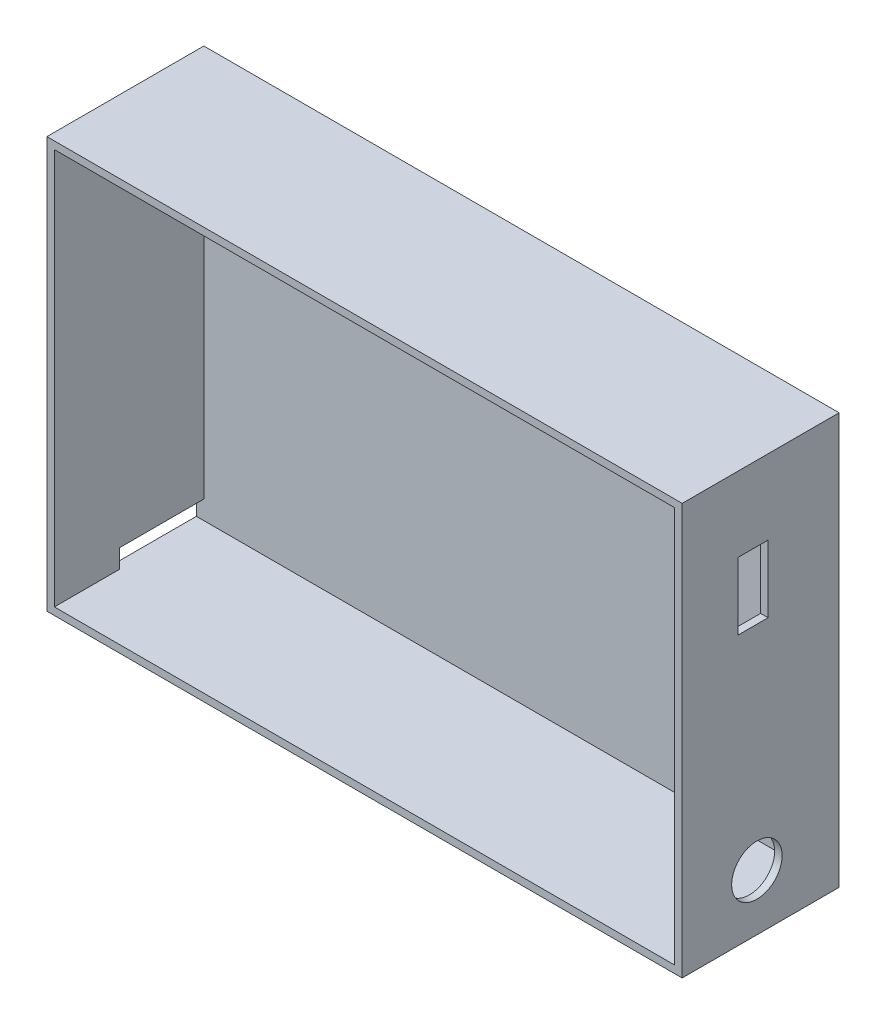
from build123d import *

# Parameters (mm, degrees)
SKETCH1_W           = 170
SKETCH1_H           = 110
BOSS_EXTRUDE1_DEPTH = 2
SKETCH2_W           = 170
SKETCH2_H           = 110
SKETCH2_W_2         = 166
SKETCH2_H_2         = 106
BOSS_EXTRUDE2_DEPTH = 40
SKETCH3_R           = 6.75
SKETCH3_W           = 8
SKETCH3_H           = 18
CUT_EXTRUDE1_DEPTH  = 2
SKETCH4_W           = 22.608078914
SKETCH4_H           = 5
CUT_EXTRUDE2_DEPTH  = 2


with BuildPart() as part:
    # Sketch1 → Boss-Extrude1 (new body)
    with BuildSketch(Plane.XY):
        Rectangle(SKETCH1_W, SKETCH1_H)
    extrude(amount=BOSS_EXTRUDE1_DEPTH)

    # Sketch2 → Boss-Extrude2 (add)
    with BuildSketch(Plane.XY.offset(2)):
        Rectangle(SKETCH2_W, SKETCH2_H)
        Rectangle(SKETCH2_W_2, SKETCH2_H_2, mode=Mode.SUBTRACT)
    extrude(amount=BOSS_EXTRUDE2_DEPTH)

    # Sketch3 → Cut-Extrude1 (cut)
    with BuildSketch(Plane(origin=(85, 0, 0), x_dir=(0, 0, -1), z_dir=(1, 0, 0))):
        with Locations(Location((-22, -39.991227395, 0), (0, 0, 90))):
            Circle(SKETCH3_R)
        with Locations((-23, 26)):
            Rectangle(SKETCH3_W, SKETCH3_H)
    extrude(amount=-CUT_EXTRUDE1_DEPTH, mode=Mode.SUBTRACT)

    # Sketch4 → Cut-Extrude2 (cut)
    with BuildSketch(Plane.ZY.offset(85)):
        with Locations((13.304039457, -50.5)):
            Rectangle(SKETCH4_W, SKETCH4_H)
    extrude(amount=-CUT_EXTRUDE2_DEPTH, mode=Mode.SUBTRACT)


solid = part.part
